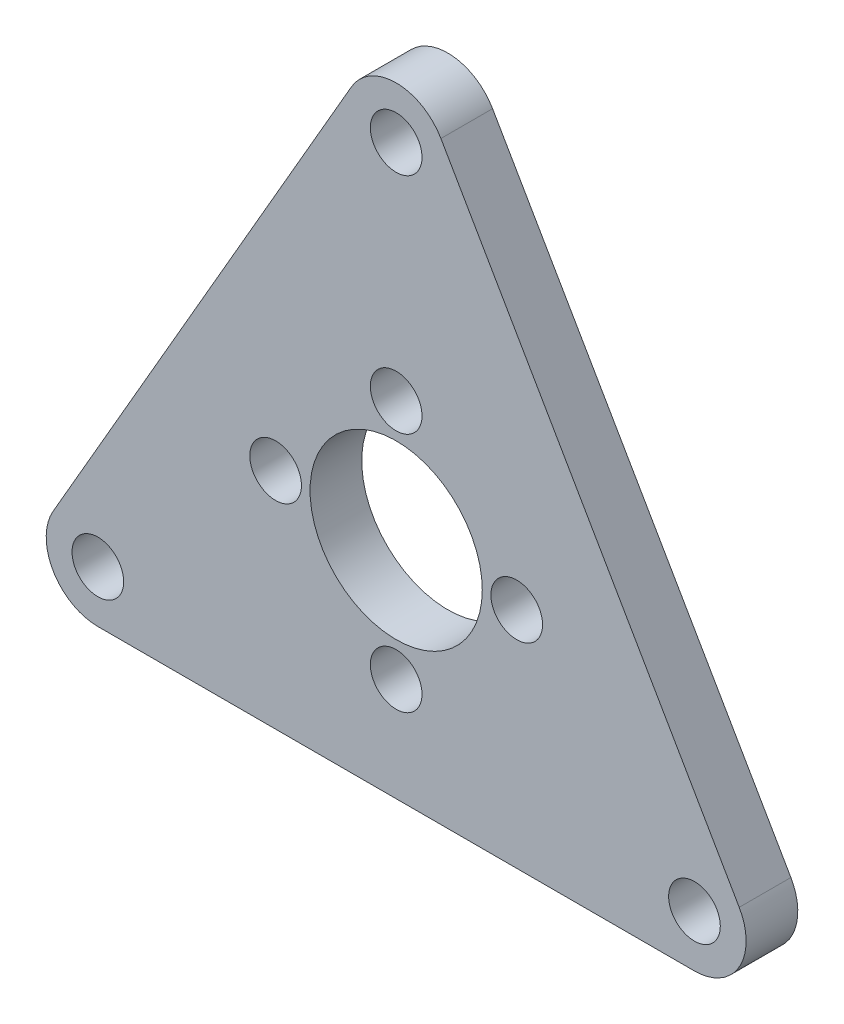
from build123d import *

# Parameters (mm, degrees)
SKETCH_1_R          = 1.5
SKETCH_1_R_2        = 5
EXTRUDE_1_DEPTH     = 3
SKETCH_2_R          = 1.5
CUT_EXTRUDE_2_DEPTH = 10


with BuildPart() as part:
    # 草图1 → 凸台-拉伸1 (new body)
    with BuildSketch(Plane.XY):
        with BuildLine():
            Line((-2.598076211, 21.5), (-19.918584287, -8.5))
            ThreePointArc((-19.918584287, -8.5), (-19.918584287, -11.5), (-17.320508076, -13))
            Line((-17.320508076, -13), (17.320508076, -13))
            ThreePointArc((17.320508076, -13), (19.918584287, -11.5), (19.918584287, -8.5))
            Line((19.918584287, -8.5), (2.598076211, 21.5))
            ThreePointArc((2.598076211, 21.5), (0, 23), (-2.598076211, 21.5))
        make_face()
        with Locations((-17.320508076, -10)):
            Circle(SKETCH_1_R, mode=Mode.SUBTRACT)
        with Locations((0, 20)):
            Circle(SKETCH_1_R, mode=Mode.SUBTRACT)
        with Locations((17.320508076, -10)):
            Circle(SKETCH_1_R, mode=Mode.SUBTRACT)
        Circle(SKETCH_1_R_2, mode=Mode.SUBTRACT)
        with Locations((0, 7)):
            Circle(SKETCH_1_R, mode=Mode.SUBTRACT)
        with Locations((0, -7)):
            Circle(SKETCH_1_R, mode=Mode.SUBTRACT)
    extrude(amount=EXTRUDE_1_DEPTH)

    # 草图2 → 切除-拉伸2 (cut)
    with BuildSketch(Plane.XY):
        with Locations((7, 0)):
            Circle(SKETCH_2_R)
        with Locations(Location((-7, 0, 0), (0, 0, 180))):
            Circle(SKETCH_2_R)
    extrude(amount=CUT_EXTRUDE_2_DEPTH, mode=Mode.SUBTRACT)


solid = part.part
